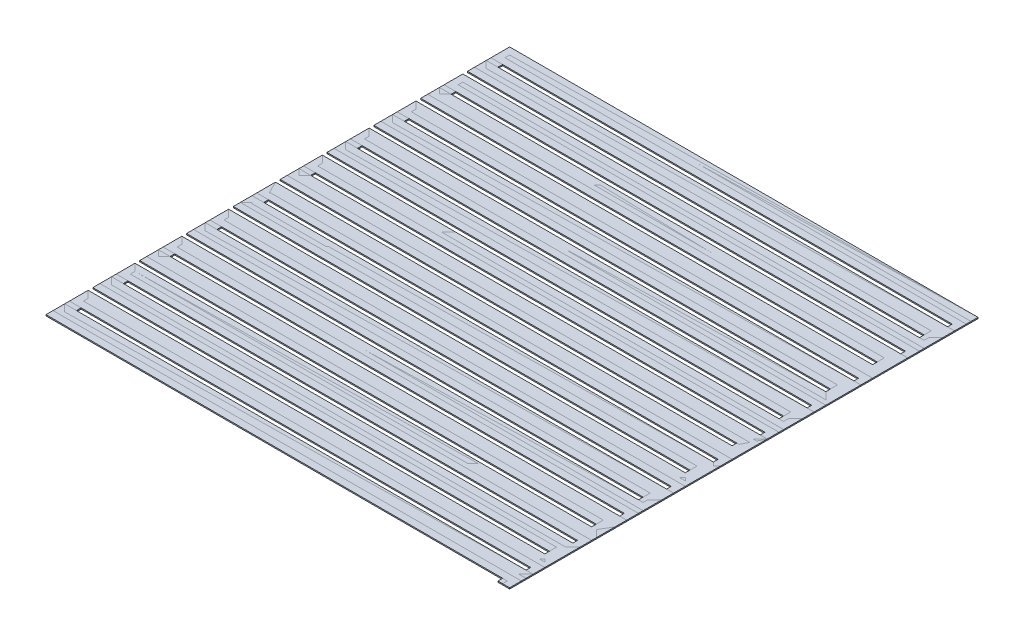
from build123d import *

# Parameters (mm, degrees)
EXTRUDED_OBJECT_DEPTH = 0.05
BOSS_EXTRUDE2_DEPTH   = 0.05
LPATTERN1_COUNT       = 19
LPATTERN1_PITCH       = 1
SKETCH1_W             = 0.3
SKETCH1_H             = 0.2
BOSS_EXTRUDE3_DEPTH   = 0.05
SKETCH2_W             = 20
SKETCH2_H             = 20
BOSS_EXTRUDE4_DEPTH   = 0.05
SKETCH3_W             = 19.5
SKETCH3_H             = 0.5
CUT_EXTRUDE3_DEPTH    = 0.05
SKETCH4_W             = 19.5
SKETCH4_H             = 0.5
CUT_EXTRUDE5_DEPTH    = 0.05
LPATTERN2_COUNT       = 10
LPATTERN2_PITCH       = 2
LPATTERN3_COUNT       = 10
LPATTERN3_PITCH       = 2


with BuildPart() as part:
    # TopBlock → Extruded object (new body)
    with BuildSketch(Plane(origin=(0, 0, 0), x_dir=(1, 0, 0), z_dir=(0, 1, 0))):
        Polygon((-10, 10), (-9.7, 10), (10, 10), (10, 9.7), (-9.7, 9.7), (-9.7, 9.5), (9.7, 9.5), (10, 9.5), (10, 9.2), (9.7, 9.2), (-9.7, 9.2), (-10, 9.2), (-10, 9.5), (-10, 9.7), align=None)
    extrude(amount=EXTRUDED_OBJECT_DEPTH)

    # GapandInbetween → Boss-Extrude2 (add)
    with BuildSketch(Plane(origin=(0, 0, 0), x_dir=(1, 0, 0), z_dir=(0, 1, 0))):
        Polygon((10, 9.2), (10, 9), (10, 8.7), (-9.7, 8.7), (-9.7, 8.5), (10, 8.5), (10, 8.2), (9.7, 8.2), (-10, 8.2), (-10, 8.5), (-10, 8.7), (-10, 9), (9.7, 9), (9.7, 9.2), align=None)
    boss_extrude2 = extrude(amount=BOSS_EXTRUDE2_DEPTH)

    # LPattern1: Boss-Extrude2 ×19
    with Locations(*[(0, 0, i * LPATTERN1_PITCH) for i in range(1, LPATTERN1_COUNT)]):
        add(boss_extrude2)

    # Sketch1 → Boss-Extrude3 (add)
    with BuildSketch(Plane(origin=(0, 0, 0), x_dir=(1, 0, 0), z_dir=(0, 1, 0))):
        with Locations((9.85, -9.9)):
            Rectangle(SKETCH1_W, SKETCH1_H)
    extrude(amount=BOSS_EXTRUDE3_DEPTH)


with BuildPart() as body_2:
    # Sketch2 → Boss-Extrude4 (new body)
    with BuildSketch(Plane(origin=(0, 0, 0), x_dir=(1, 0, 0), z_dir=(0, 1, 0))):
        Rectangle(SKETCH2_W, SKETCH2_H)
    extrude(amount=BOSS_EXTRUDE4_DEPTH)

    # Sketch3 → Cut-Extrude3 (cut)
    with BuildSketch(Plane(origin=(0, 0, 0), x_dir=(1, 0, 0), z_dir=(0, 1, 0))):
        with Locations((0.25, 9.25)):
            Rectangle(SKETCH3_W, SKETCH3_H)
    cut_extrude3 = extrude(amount=CUT_EXTRUDE3_DEPTH, mode=Mode.SUBTRACT)

    # Sketch4 → Cut-Extrude5 (cut)
    with BuildSketch(Plane(origin=(0, 0, 0), x_dir=(1, 0, 0), z_dir=(0, 1, 0))):
        with Locations((-0.25, 8.25)):
            Rectangle(SKETCH4_W, SKETCH4_H)
    cut_extrude5 = extrude(amount=CUT_EXTRUDE5_DEPTH, mode=Mode.SUBTRACT)

    # LPattern2: Cut-Extrude3 ×10
    with Locations(*[(0, 0, i * LPATTERN2_PITCH) for i in range(1, LPATTERN2_COUNT)]):
        add(cut_extrude3, mode=Mode.SUBTRACT)

    # LPattern3: Cut-Extrude5 ×10
    with Locations(*[(0, 0, i * LPATTERN3_PITCH) for i in range(1, LPATTERN3_COUNT)]):
        add(cut_extrude5, mode=Mode.SUBTRACT)


solid = Compound([part.part, body_2.part])
